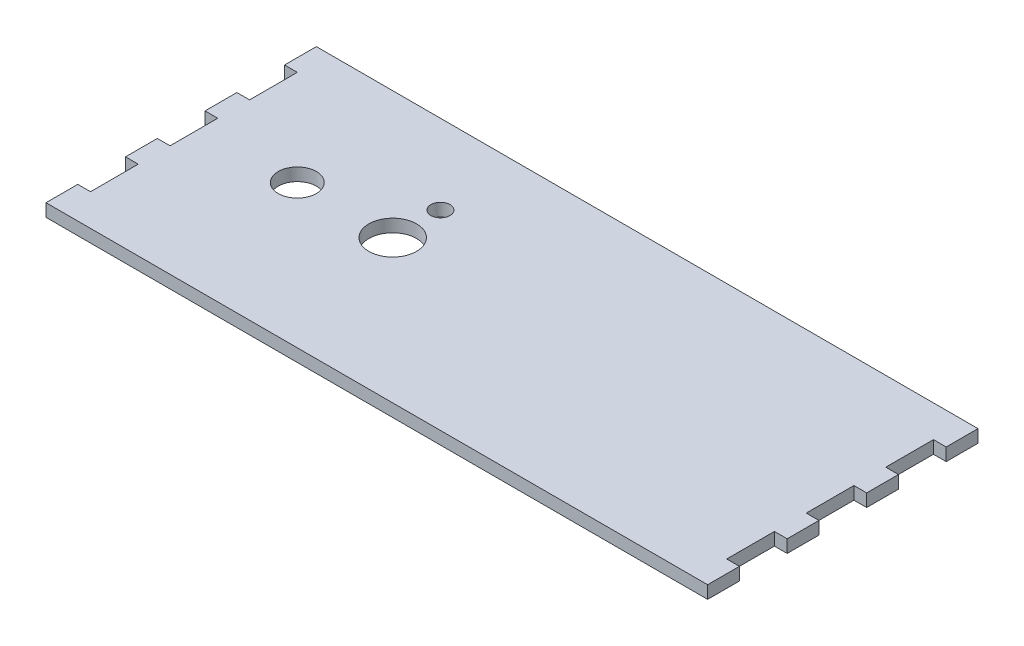
from build123d import *

# Parameters (mm, degrees)
SKETCH1_W           = 4
SKETCH1_H           = 10
SKETCH1_W_2         = 200
SKETCH1_H_2         = 85
SKETCH1_R           = 3
SKETCH1_R_2         = 7.5
SKETCH1_R_3         = 6
BOSS_EXTRUDE4_DEPTH = 4


with BuildPart() as part:
    # Sketch1 → Boss-Extrude4 (new body)
    # profile 1 of 9: a face of its own
    with BuildSketch(Plane(origin=(0, 0, 0), x_dir=(1, 0, 0), z_dir=(0, 1, 0))):
        with Locations((-2, 80)):
            Rectangle(SKETCH1_W, SKETCH1_H)
    # profile 2 of 9: a face of its own
    with BuildSketch(Plane(origin=(0, 0, 0), x_dir=(1, 0, 0), z_dir=(0, 1, 0))):
        with Locations((-2, 55)):
            Rectangle(SKETCH1_W, SKETCH1_H)
    # profile 3 of 9: a face of its own
    with BuildSketch(Plane(origin=(0, 0, 0), x_dir=(1, 0, 0), z_dir=(0, 1, 0))):
        with Locations((-2, 30)):
            Rectangle(SKETCH1_W, SKETCH1_H)
    # profile 4 of 9: a face of its own
    with BuildSketch(Plane(origin=(0, 0, 0), x_dir=(1, 0, 0), z_dir=(0, 1, 0))):
        with Locations((-2, 5)):
            Rectangle(SKETCH1_W, SKETCH1_H)
    # profile 5 of 9: a face of its own
    with BuildSketch(Plane(origin=(0, 0, 0), x_dir=(1, 0, 0), z_dir=(0, 1, 0))):
        with Locations((202, 5)):
            Rectangle(SKETCH1_W, SKETCH1_H)
    # profile 6 of 9: a face of its own
    with BuildSketch(Plane(origin=(0, 0, 0), x_dir=(1, 0, 0), z_dir=(0, 1, 0))):
        with Locations((202, 30)):
            Rectangle(SKETCH1_W, SKETCH1_H)
    # profile 7 of 9: a face of its own
    with BuildSketch(Plane(origin=(0, 0, 0), x_dir=(1, 0, 0), z_dir=(0, 1, 0))):
        with Locations((202, 55)):
            Rectangle(SKETCH1_W, SKETCH1_H)
    # profile 8 of 9: a face of its own
    with BuildSketch(Plane(origin=(0, 0, 0), x_dir=(1, 0, 0), z_dir=(0, 1, 0))):
        with Locations((202, 80)):
            Rectangle(SKETCH1_W, SKETCH1_H)
    # profile 9 of 9: a face of its own
    with BuildSketch(Plane(origin=(0, 0, 0), x_dir=(1, 0, 0), z_dir=(0, 1, 0))):
        with Locations((100, 42.5)):
            Rectangle(SKETCH1_W_2, SKETCH1_H_2)
        with Locations(Location((60, 60, 0), (0, 0, 270))):
            Circle(SKETCH1_R, mode=Mode.SUBTRACT)
        with Locations(Location((60, 45, 0), (0, 0, 270))):
            Circle(SKETCH1_R_2, mode=Mode.SUBTRACT)
        with Locations(Location((30, 45, 0), (0, 0, 270))):
            Circle(SKETCH1_R_3, mode=Mode.SUBTRACT)
    extrude(amount=BOSS_EXTRUDE4_DEPTH)


solid = part.part
